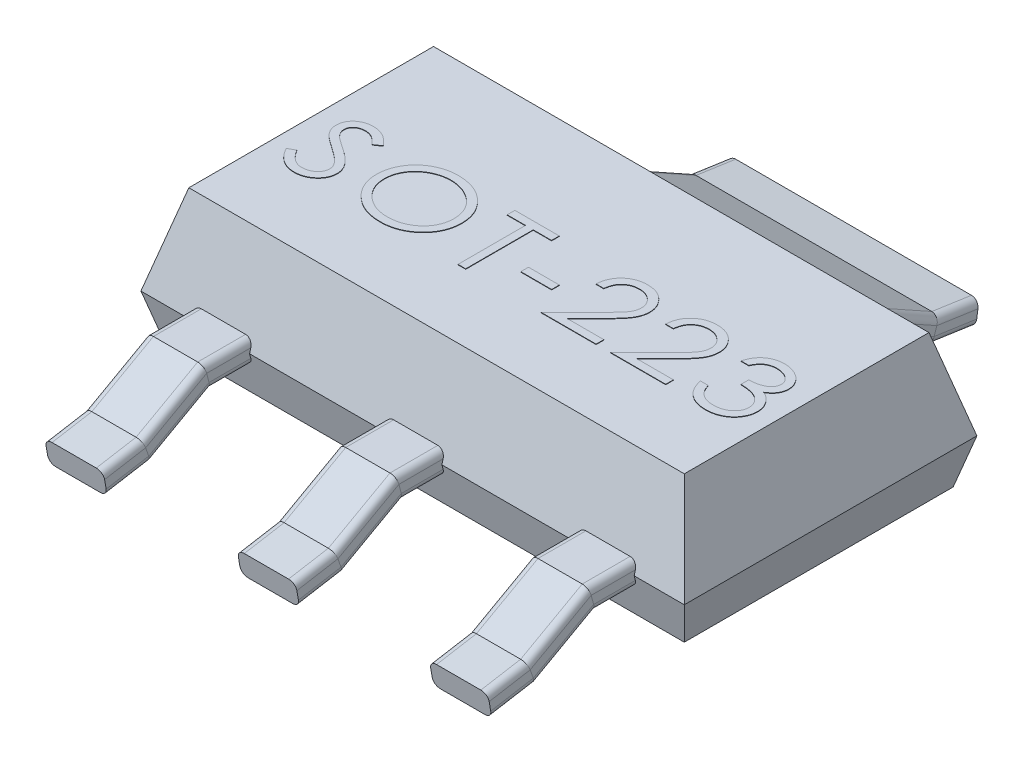
from build123d import *

# Parameters (mm, degrees)
SKETCH1_W                     = 6.5
SKETCH1_H                     = 3.5
BOSS_EXTRUDE1_DEPTH           = 1.07
BOSS_EXTRUDE1_TAPER           = 15
BOSS_EXTRUDE1_OTHER_WAY_DEPTH = 0.53
BOSS_EXTRUDE1_OTHER_WAY_TAPER = 15
SKETCH12_W                    = 0.369230769
SKETCH12_H                    = 0.092307693
BOSS_EXTRUDE2_DEPTH           = 0.005


with BuildPart() as part:
    # Sketch1 → Boss-Extrude1 (new body)
    with BuildSketch(Plane(origin=(0, 0, 0), x_dir=(1, 0, 0), z_dir=(0, 1, 0))):
        Rectangle(SKETCH1_W, SKETCH1_H)
    extrude(amount=BOSS_EXTRUDE1_DEPTH, taper=BOSS_EXTRUDE1_TAPER)

    # Sketch1 → Boss-Extrude1 other way (add)
    with BuildSketch(Plane(origin=(0, 0, 0), x_dir=(1, 0, 0), z_dir=(0, 1, 0))):
        Rectangle(SKETCH1_W, SKETCH1_H)
    extrude(amount=-BOSS_EXTRUDE1_OTHER_WAY_DEPTH, taper=BOSS_EXTRUDE1_OTHER_WAY_TAPER)

    # Sweep1: sweep along a path in Sketch6
    with BuildLine(Plane(origin=(0, 0, 0), x_dir=(0, 0, -1), z_dir=(1, 0, 0))) as sweep1_path:
        Line((-1.607986928, 0), (-2.249183788, 0))
        Line((-2.249183788, 0), (-2.975, -0.404719372))
        Line((-2.975, -0.404719372), (-3.475, -0.49))
    # Sketch4 → Sweep1 (sweep)
    with BuildSketch(Plane.XY.offset(1.607986928)):
        with BuildLine():
            Line((0.264582907, -0.14), (-0.264582907, -0.14))
            ThreePointArc((-0.264582907, -0.14), (-0.324981913, -0.114981913), (-0.35, -0.054582907))
            Line((-0.35, -0.054582907), (-0.35, 0.054582907))
            ThreePointArc((-0.35, 0.054582907), (-0.324981913, 0.114981913), (-0.264582907, 0.14))
            Line((-0.264582907, 0.14), (0.264582907, 0.14))
            ThreePointArc((0.264582907, 0.14), (0.324981913, 0.114981913), (0.35, 0.054582907))
            Line((0.35, 0.054582907), (0.35, -0.054582907))
            ThreePointArc((0.35, -0.054582907), (0.324981913, -0.114981913), (0.264582907, -0.14))
        make_face()
        with BuildLine():
            Line((2.564582907, -0.14), (2.035417093, -0.14))
            ThreePointArc((2.035417093, -0.14), (1.975018087, -0.114981913), (1.95, -0.054582907))
            Line((1.95, -0.054582907), (1.95, 0.054582907))
            ThreePointArc((1.95, 0.054582907), (1.975018087, 0.114981913), (2.035417093, 0.14))
            Line((2.035417093, 0.14), (2.564582907, 0.14))
            ThreePointArc((2.564582907, 0.14), (2.624981913, 0.114981913), (2.65, 0.054582907))
            Line((2.65, 0.054582907), (2.65, -0.054582907))
            ThreePointArc((2.65, -0.054582907), (2.624981913, -0.114981913), (2.564582907, -0.14))
        make_face()
        with BuildLine():
            Line((-2.564582907, 0.14), (-2.035417093, 0.14))
            ThreePointArc((-2.035417093, 0.14), (-1.975018087, 0.114981913), (-1.95, 0.054582907))
            Line((-1.95, 0.054582907), (-1.95, -0.054582907))
            ThreePointArc((-1.95, -0.054582907), (-1.975018087, -0.114981913), (-2.035417093, -0.14))
            Line((-2.035417093, -0.14), (-2.564582907, -0.14))
            ThreePointArc((-2.564582907, -0.14), (-2.624981913, -0.114981913), (-2.65, -0.054582907))
            Line((-2.65, -0.054582907), (-2.65, 0.054582907))
            ThreePointArc((-2.65, 0.054582907), (-2.624981913, 0.114981913), (-2.564582907, 0.14))
        make_face()
    sweep(path=sweep1_path.line, transition=Transition.RIGHT)

    # Sweep2: sweep along a path in Sketch10
    with BuildLine(Plane(origin=(0, 0, 0), x_dir=(0, 0, -1), z_dir=(1, 0, 0))) as sweep2_path:
        Line((3.504979243, -0.49), (3.004979243, -0.417264524))
        Line((3.004979243, -0.417264524), (2.256664789, 0))
        Line((2.256664789, 0), (1.607986928, 0))
    # Sketch9 → Sweep2 (sweep)
    with BuildSketch(Plane.XY.offset(-1.607986928)):
        with BuildLine():
            Line((1.41, 0.14), (-1.41, 0.14))
            ThreePointArc((-1.41, 0.14), (-1.47363961, 0.11363961), (-1.5, 0.05))
            Line((-1.5, 0.05), (-1.5, -0.05))
            ThreePointArc((-1.5, -0.05), (-1.47363961, -0.11363961), (-1.41, -0.14))
            Line((-1.41, -0.14), (1.41, -0.14))
            ThreePointArc((1.41, -0.14), (1.47363961, -0.11363961), (1.5, -0.05))
            Line((1.5, -0.05), (1.5, 0.05))
            ThreePointArc((1.5, 0.05), (1.47363961, 0.11363961), (1.41, 0.14))
        make_face()
    sweep(path=sweep2_path.line, transition=Transition.RIGHT)

    # Sketch12 → Boss-Extrude2 (add)
    # profile 1 of 7: a face of its own
    with BuildSketch(Plane(origin=(0, 1.07, 0), x_dir=(1, 0, 0), z_dir=(0, 1, 0))):
        with BuildLine():
            Line((-2.784230769, -0.478496856), (-2.701838942, -0.432883875))
            add(Edge.make_bspline(
                [(-2.701838942, -0.432883875), (-2.694488246, -0.444753328), (-2.680348045, -0.467586058), (-2.656415422, -0.498095754), (-2.631906469, -0.524138188), (-2.606525769, -0.545627693), (-2.580044955, -0.562216427), (-2.552673626, -0.574147432), (-2.524342713, -0.581549429), (-2.505067301, -0.582438416), (-2.495408654, -0.582883875)],
                knots=[0, 0, 0, 0, 1.253021552, 2.410380904, 3.475470111, 4.460185, 5.388689421, 6.270994921, 7.133619014, 8, 8, 8, 8], degree=3))
            add(Edge.make_bspline(
                [(-2.495408654, -0.582883875), (-2.487158294, -0.582662764), (-2.470800202, -0.582224365), (-2.446746881, -0.578067547), (-2.423429845, -0.571614719), (-2.401285478, -0.562409698), (-2.380590878, -0.551247087), (-2.362315159, -0.537917094), (-2.346709106, -0.522736785), (-2.333902149, -0.505928174), (-2.323806885, -0.487936098), (-2.316548155, -0.46924524), (-2.311955589, -0.449991606), (-2.311422392, -0.436935552), (-2.311153846, -0.430359837)],
                knots=[0, 0, 0, 0, 1.117334146, 2.215352634, 3.29837511, 4.390456354, 5.45848967, 6.478319752, 7.445976648, 8.398987977, 9.332517181, 10.232504492, 11.109796257, 12, 12, 12, 12], degree=3))
            add(Edge.make_bspline(
                [(-2.311153846, -0.430359837), (-2.311599386, -0.422866486), (-2.312505722, -0.407623212), (-2.319132606, -0.385070271), (-2.330000701, -0.362808494), (-2.340008848, -0.349144585), (-2.345228365, -0.342018491)],
                knots=[0, 0, 0, 0, 0.931829012, 1.895563707, 2.902480149, 4, 4, 4, 4], degree=3))
            add(Edge.make_bspline(
                [(-2.345228365, -0.342018491), (-2.349493998, -0.336856549), (-2.35847227, -0.325991735), (-2.373938328, -0.30996128), (-2.391895174, -0.293217446), (-2.412171835, -0.275594354), (-2.435049514, -0.257442637), (-2.460088111, -0.238270312), (-2.48769912, -0.218450984), (-2.50715362, -0.205310556), (-2.517223558, -0.198508875)],
                knots=[0, 0, 0, 0, 0.714762393, 1.504426282, 2.375974636, 3.335718653, 4.371867423, 5.493494949, 6.702595789, 8, 8, 8, 8], degree=3))
            add(Edge.make_bspline(
                [(-2.517223558, -0.198508875), (-2.527236227, -0.19177076), (-2.546366407, -0.178896934), (-2.57313001, -0.159674008), (-2.597197007, -0.142320826), (-2.618148596, -0.126156853), (-2.63630175, -0.111752684), (-2.65144936, -0.098695843), (-2.663575264, -0.087093537), (-2.670328376, -0.079496173), (-2.673353365, -0.07609301)],
                knots=[0, 0, 0, 0, 1.456563732, 2.782907058, 3.976925193, 5.037437426, 5.976523114, 6.773507667, 7.450604967, 8, 8, 8, 8], degree=3))
            add(Edge.make_bspline(
                [(-2.673353365, -0.07609301), (-2.677582464, -0.070805441), (-2.685873629, -0.060439142), (-2.696711174, -0.044095556), (-2.706091796, -0.027488515), (-2.71327968, -0.010326352), (-2.719491223, 0.006920711), (-2.723589734, 0.024647686), (-2.725926231, 0.0427144), (-2.726334195, 0.054849961), (-2.726538462, 0.060926221)],
                knots=[0, 0, 0, 0, 1.082001755, 2.121268478, 3.131939468, 4.126079838, 5.092343318, 6.059513975, 7.028401166, 8, 8, 8, 8], degree=3))
            add(Edge.make_bspline(
                [(-2.726538462, 0.060926221), (-2.726151334, 0.070450474), (-2.725384535, 0.089315537), (-2.719441529, 0.116898525), (-2.709779078, 0.143168277), (-2.696431857, 0.16793306), (-2.679358127, 0.190700992), (-2.659149619, 0.2111639), (-2.63560887, 0.228817858), (-2.609460353, 0.243853889), (-2.581019422, 0.25579467), (-2.551211781, 0.264796493), (-2.520039579, 0.269853828), (-2.498911503, 0.270589306), (-2.488197115, 0.270962279)],
                knots=[0, 0, 0, 0, 0.967956048, 1.917268652, 2.855042101, 3.806653596, 4.767386207, 5.739731228, 6.721252043, 7.750674316, 8.799524247, 9.851450016, 10.91043571, 12, 12, 12, 12], degree=3))
            add(Edge.make_bspline(
                [(-2.488197115, 0.270962279), (-2.476813181, 0.270651339), (-2.454195832, 0.27003357), (-2.420993946, 0.264003731), (-2.388863038, 0.254593096), (-2.363044914, 0.243543813), (-2.342694077, 0.23264659), (-2.327299779, 0.222560911), (-2.311671037, 0.210969475), (-2.295589542, 0.198074834), (-2.279544633, 0.183354426), (-2.263315983, 0.16704689), (-2.246757541, 0.149265227), (-2.235928542, 0.136627102), (-2.230384615, 0.13015699)],
                knots=[0, 0, 0, 0, 1.343581969, 2.669398873, 3.972209689, 5.29212177, 5.978229007, 6.696944897, 7.463666474, 8.276335723, 9.130634109, 10.034185422, 10.993597435, 12, 12, 12, 12], degree=3))
            Line((-2.230384615, 0.13015699), (-2.309350962, 0.074808432))
            add(Edge.make_bspline(
                [(-2.309350962, 0.074808432), (-2.31401641, 0.079876873), (-2.323056696, 0.08969804), (-2.336515698, 0.103596241), (-2.349569652, 0.116030046), (-2.361924035, 0.12733908), (-2.374058696, 0.136940539), (-2.385365851, 0.145623047), (-2.39638318, 0.15255223), (-2.410057521, 0.160357008), (-2.427485229, 0.167690514), (-2.449125823, 0.174072852), (-2.471712817, 0.177939631), (-2.487100604, 0.178414759), (-2.494867788, 0.178654586)],
                knots=[0, 0, 0, 0, 1.1264946, 2.182819734, 3.162837221, 4.074442579, 4.920099024, 5.692522356, 6.404030606, 7.046419284, 8.265828538, 9.484802126, 10.730421381, 12, 12, 12, 12], degree=3))
            add(Edge.make_bspline(
                [(-2.494867788, 0.178654586), (-2.504703846, 0.178344558), (-2.523637733, 0.177747771), (-2.550520138, 0.171205053), (-2.574696104, 0.160920139), (-2.592217749, 0.148694414), (-2.604485827, 0.137538188), (-2.612300165, 0.128471135), (-2.619291317, 0.119233846), (-2.624632595, 0.109122149), (-2.629105787, 0.098742263), (-2.631816537, 0.087700712), (-2.63404079, 0.076399304), (-2.634167079, 0.068630355), (-2.634230769, 0.064712279)],
                knots=[0, 0, 0, 0, 1.760232571, 3.388353894, 4.927632624, 6.445876884, 7.19313098, 7.895540244, 8.589469407, 9.264487784, 9.940794775, 10.609853562, 11.298914165, 12, 12, 12, 12], degree=3))
            add(Edge.make_bspline(
                [(-2.634230769, 0.064712279), (-2.634045796, 0.059893345), (-2.633675678, 0.050250979), (-2.631027071, 0.03592317), (-2.626899811, 0.021742123), (-2.620808381, 0.007630357), (-2.612539528, -0.006745368), (-2.60133824, -0.021282917), (-2.587537574, -0.036480002), (-2.577033751, -0.046359761), (-2.571490385, -0.051573779)],
                knots=[0, 0, 0, 0, 0.847316756, 1.695424412, 2.55504833, 3.440604087, 4.39250749, 5.464392083, 6.661839371, 8, 8, 8, 8], degree=3))
            add(Edge.make_bspline(
                [(-2.571490385, -0.051573779), (-2.569401247, -0.053334338), (-2.564425619, -0.057527402), (-2.555341728, -0.064300894), (-2.543474714, -0.072856018), (-2.528849215, -0.083162924), (-2.511494684, -0.095349579), (-2.49125151, -0.108950412), (-2.468348369, -0.124534181), (-2.452087078, -0.135419365), (-2.443485577, -0.141177145)],
                knots=[0, 0, 0, 0, 0.419436643, 0.998958289, 1.739145775, 2.665983594, 3.746274523, 4.995278854, 6.410635948, 8, 8, 8, 8], degree=3))
            add(Edge.make_bspline(
                [(-2.443485577, -0.141177145), (-2.433106605, -0.148268333), (-2.413070221, -0.16195772), (-2.384669831, -0.182810227), (-2.358679462, -0.202915941), (-2.335274825, -0.222510398), (-2.314397287, -0.241456121), (-2.296153043, -0.259913951), (-2.280162251, -0.277614763), (-2.266893926, -0.295162606), (-2.255589038, -0.312312016), (-2.245804866, -0.32927751), (-2.237482792, -0.346260001), (-2.230569857, -0.363213436), (-2.225235617, -0.38027179), (-2.221803102, -0.397391138), (-2.219191913, -0.41447572), (-2.218961483, -0.425902678), (-2.218846154, -0.431621856)],
                knots=[0, 0, 0, 0, 1.578022906, 3.046339409, 4.422727009, 5.702703616, 6.8776146, 7.96063192, 8.960000702, 9.869926452, 10.719515136, 11.53742413, 12.327003532, 13.091975727, 13.834173186, 14.566643069, 15.282606682, 16, 16, 16, 16], degree=3))
            add(Edge.make_bspline(
                [(-2.218846154, -0.431621856), (-2.21907877, -0.439691222), (-2.219539672, -0.455679764), (-2.223519202, -0.479169863), (-2.229548097, -0.501976408), (-2.238577413, -0.52382809), (-2.2497299, -0.545049608), (-2.263559974, -0.565331708), (-2.279950404, -0.584697598), (-2.298495385, -0.603009069), (-2.318747454, -0.619947035), (-2.340382729, -0.634698437), (-2.363081265, -0.647333205), (-2.386958863, -0.657334974), (-2.411855312, -0.665376358), (-2.437806018, -0.67109332), (-2.464901118, -0.674645662), (-2.483318172, -0.675007274), (-2.492704327, -0.675191568)],
                knots=[0, 0, 0, 0, 0.951595583, 1.885479558, 2.80416064, 3.72995842, 4.668998158, 5.628881797, 6.620439808, 7.65848502, 8.700881629, 9.731609297, 10.744171855, 11.761046479, 12.781500572, 13.827629713, 14.892862811, 16, 16, 16, 16], degree=3))
            add(Edge.make_bspline(
                [(-2.492704327, -0.675191568), (-2.499982703, -0.675064572), (-2.514331904, -0.674814202), (-2.535571528, -0.672473753), (-2.556347273, -0.669224233), (-2.576539261, -0.664036892), (-2.596318981, -0.657742208), (-2.615578489, -0.650041586), (-2.634261164, -0.640709285), (-2.652533408, -0.630112587), (-2.670376489, -0.617691963), (-2.687800185, -0.603478464), (-2.704844247, -0.587318896), (-2.721364291, -0.569174186), (-2.737842685, -0.54934394), (-2.753822877, -0.527531625), (-2.769387192, -0.503772631), (-2.779193738, -0.487073958), (-2.784230769, -0.478496856)],
                knots=[0, 0, 0, 0, 0.9415657, 1.856281696, 2.762794391, 3.66065843, 4.551013359, 5.447866327, 6.341746891, 7.251456702, 8.179140589, 9.152078792, 10.158839414, 11.215634977, 12.32593623, 13.494135372, 14.712888492, 16, 16, 16, 16], degree=3))
        make_face()
    # profile 2 of 7: a face of its own
    with BuildSketch(Plane(origin=(0, 1.07, 0), x_dir=(1, 0, 0), z_dir=(0, 1, 0))):
        with BuildLine():
            add(Edge.make_bspline(
                [(-1.474002404, 0.270962279), (-1.456077081, 0.270538981), (-1.42089361, 0.269708141), (-1.369253317, 0.263401471), (-1.319980301, 0.252380756), (-1.272683413, 0.237814507), (-1.227832317, 0.21832086), (-1.185164796, 0.194781381), (-1.144791581, 0.16683965), (-1.107072918, 0.134948296), (-1.072697091, 0.10010053), (-1.042390572, 0.062988861), (-1.017187686, 0.02359048), (-0.995888227, -0.017471306), (-0.979962811, -0.060846308), (-0.968298992, -0.106058302), (-0.961356905, -0.153281929), (-0.960456542, -0.185445211), (-0.96, -0.201754068)],
                knots=[0, 0, 0, 0, 1.104339174, 2.167575275, 3.19895946, 4.211974237, 5.212103104, 6.206540156, 7.210035823, 8.232212855, 9.245525355, 10.222267028, 11.178495095, 12.122427609, 13.066774007, 14.018748382, 14.995377748, 16, 16, 16, 16], degree=3))
            add(Edge.make_bspline(
                [(-0.96, -0.201754068), (-0.960454531, -0.21794357), (-0.961350867, -0.249869247), (-0.968329291, -0.296782845), (-0.979930058, -0.341779888), (-0.996035118, -0.384972843), (-1.01686575, -0.42628543), (-1.042543926, -0.465566582), (-1.072600754, -0.503014694), (-1.106883738, -0.538092949), (-1.144372688, -0.570063489), (-1.184292524, -0.598242846), (-1.226187146, -0.622195315), (-1.270357832, -0.64150922), (-1.316381181, -0.656776704), (-1.364550627, -0.667279716), (-1.414616801, -0.674013804), (-1.448739976, -0.674794888), (-1.466069712, -0.675191568)],
                knots=[0, 0, 0, 0, 1.006897034, 1.98559964, 2.943186421, 3.893189035, 4.847917768, 5.815452073, 6.80748931, 7.830684368, 8.862341799, 9.868509738, 10.866468422, 11.859160648, 12.862936224, 13.87796334, 14.922306222, 16, 16, 16, 16], degree=3))
            add(Edge.make_bspline(
                [(-1.466069712, -0.675191568), (-1.483579566, -0.674795527), (-1.51806165, -0.674015607), (-1.568723812, -0.667262522), (-1.617360784, -0.656809873), (-1.663847693, -0.641709367), (-1.708232444, -0.622334866), (-1.750591497, -0.598638511), (-1.790733408, -0.570521116), (-1.828325751, -0.538586081), (-1.862702584, -0.503799584), (-1.892921449, -0.466692395), (-1.918215386, -0.427562325), (-1.939140967, -0.386761999), (-1.955499355, -0.344170401), (-1.967019754, -0.299725342), (-1.974041451, -0.253480445), (-1.974932633, -0.222031158), (-1.975384615, -0.206080991)],
                knots=[0, 0, 0, 0, 1.090007837, 2.146547848, 3.177224824, 4.18441606, 5.184972819, 6.188625542, 7.201944888, 8.232227685, 9.256408654, 10.243626549, 11.2069681, 12.152656664, 13.094449289, 14.042142631, 15.007031417, 16, 16, 16, 16], degree=3))
            add(Edge.make_bspline(
                [(-1.975384615, -0.206080991), (-1.975163489, -0.195376927), (-1.974724065, -0.174105669), (-1.971601785, -0.14247401), (-1.96639283, -0.111383164), (-1.958955843, -0.080922659), (-1.949578611, -0.051019483), (-1.937991119, -0.021746458), (-1.924272774, 0.006904025), (-1.908558444, 0.034810276), (-1.891233213, 0.06176474), (-1.872013449, 0.087262075), (-1.851304446, 0.11124627), (-1.829025032, 0.133658631), (-1.805360274, 0.154616852), (-1.780210812, 0.174157916), (-1.753515848, 0.192247868), (-1.725225352, 0.20849711), (-1.696054104, 0.223317182), (-1.66597513, 0.235868553), (-1.635499268, 0.246774937), (-1.604364449, 0.255630166), (-1.572625391, 0.262495492), (-1.540277566, 0.267260504), (-1.507363853, 0.270557537), (-1.485188516, 0.270826569), (-1.474002404, 0.270962279)],
                knots=[0, 0, 0, 0, 1.000860702, 1.988923732, 2.969140983, 3.946405888, 4.918600368, 5.897447419, 6.887793071, 7.886663957, 8.890501988, 9.881803818, 10.869866848, 11.851371953, 12.834677219, 13.823874237, 14.827633617, 15.847405218, 16.872782081, 17.885187697, 18.892981817, 19.898014594, 20.909858577, 21.927149733, 22.954372848, 24, 24, 24, 24], degree=3))
        make_face()
        with BuildLine():
            add(Edge.make_bspline(
                [(-1.469675481, 0.178654586), (-1.478696766, 0.178550408), (-1.49665561, 0.178343018), (-1.523369237, 0.175613374), (-1.549749182, 0.17172418), (-1.575800081, 0.166176819), (-1.601429891, 0.158620703), (-1.62683938, 0.149909384), (-1.6518084, 0.139373915), (-1.676186958, 0.127285403), (-1.699907854, 0.114134475), (-1.722275028, 0.099491082), (-1.743271031, 0.083678811), (-1.763127923, 0.067003542), (-1.781556347, 0.049103748), (-1.798611616, 0.03007136), (-1.814263814, 0.0098415), (-1.828660436, -0.011316672), (-1.841479407, -0.033371592), (-1.852723442, -0.056101255), (-1.862091758, -0.079562688), (-1.869649863, -0.103630505), (-1.87563207, -0.128261141), (-1.879971399, -0.153491531), (-1.882524942, -0.179405656), (-1.8828915, -0.196880688), (-1.883076923, -0.205720414)],
                knots=[0, 0, 0, 0, 1.034314358, 2.059029303, 3.076765405, 4.092094375, 5.110880351, 6.139806059, 7.171636845, 8.216667878, 9.259764826, 10.280693852, 11.280175756, 12.273075775, 13.252873351, 14.224294354, 15.201858716, 16.184537379, 17.157522275, 18.125488912, 19.09060439, 20.051995777, 21.016643451, 21.995737629, 22.98614617, 24, 24, 24, 24], degree=3))
            add(Edge.make_bspline(
                [(-1.883076923, -0.205720414), (-1.882674079, -0.218719492), (-1.881881376, -0.24429864), (-1.876262796, -0.281882028), (-1.866555156, -0.317782286), (-1.853429846, -0.35234078), (-1.836113634, -0.385185253), (-1.815313051, -0.416674108), (-1.790321733, -0.44621881), (-1.762256821, -0.47421843), (-1.731319288, -0.499518877), (-1.698581925, -0.521822146), (-1.664287075, -0.540789968), (-1.62827399, -0.556011017), (-1.590865825, -0.568283042), (-1.551813123, -0.576581752), (-1.511299929, -0.582096745), (-1.483696705, -0.58261873), (-1.469675481, -0.582883875)],
                knots=[0, 0, 0, 0, 1.001985766, 1.97167371, 2.92126608, 3.864235468, 4.815363556, 5.777764185, 6.767768529, 7.793129838, 8.830022713, 9.843858898, 10.843270901, 11.845781331, 12.853757634, 13.873335827, 14.919748107, 16, 16, 16, 16], degree=3))
            add(Edge.make_bspline(
                [(-1.469675481, -0.582883875), (-1.460235428, -0.582760768), (-1.441505788, -0.582516516), (-1.413691173, -0.580089414), (-1.386412993, -0.57615904), (-1.359701336, -0.570521689), (-1.333526662, -0.56346649), (-1.307794816, -0.555080526), (-1.282780404, -0.544667815), (-1.258275722, -0.533061619), (-1.234795136, -0.519889684), (-1.212338173, -0.505734884), (-1.191420013, -0.490113052), (-1.171720921, -0.473572815), (-1.15339784, -0.455803886), (-1.136486854, -0.436827776), (-1.120678892, -0.41681667), (-1.106538792, -0.395516384), (-1.09371998, -0.373471703), (-1.082730769, -0.350650371), (-1.073288459, -0.327298121), (-1.065523494, -0.303333239), (-1.059548031, -0.278744959), (-1.055455124, -0.253545613), (-1.052853415, -0.22777009), (-1.052490602, -0.210354004), (-1.052307692, -0.201573779)],
                knots=[0, 0, 0, 0, 1.078057494, 2.138931934, 3.186396846, 4.224372019, 5.255081129, 6.281828204, 7.313085757, 8.34778727, 9.37721554, 10.386466275, 11.377698063, 12.356805186, 13.322831121, 14.290221845, 15.258318578, 16.233084811, 17.207971885, 18.168911637, 19.123652981, 20.083145109, 21.043790605, 22.010913397, 22.997212883, 24, 24, 24, 24], degree=3))
            add(Edge.make_bspline(
                [(-1.052307692, -0.201573779), (-1.052490691, -0.192853639), (-1.052853663, -0.175557469), (-1.055453782, -0.149961364), (-1.059552463, -0.124943431), (-1.06549451, -0.100584354), (-1.073292895, -0.076927824), (-1.082731661, -0.053934391), (-1.093727044, -0.031475942), (-1.106532264, -0.009781501), (-1.12074564, 0.01116192), (-1.136470563, 0.031049395), (-1.153655592, 0.049766203), (-1.172083743, 0.067613382), (-1.192134787, 0.084023682), (-1.213312285, 0.099745903), (-1.236051986, 0.114051445), (-1.259946386, 0.127349985), (-1.284665779, 0.139372363), (-1.309945144, 0.149867931), (-1.335677562, 0.158693925), (-1.361701733, 0.166139712), (-1.388216536, 0.171751448), (-1.415024301, 0.17559526), (-1.442214593, 0.178351917), (-1.460473747, 0.178553166), (-1.469675481, 0.178654586)],
                knots=[0, 0, 0, 0, 0.999618921, 1.982718035, 2.946629433, 3.904142108, 4.854089328, 5.799603779, 6.751722253, 7.718313886, 8.685273778, 9.65154614, 10.6220342, 11.596597958, 12.589904812, 13.590354425, 14.618671442, 15.667306976, 16.72423902, 17.768315198, 18.803281207, 19.841475733, 20.86981583, 21.90753015, 22.945496034, 24, 24, 24, 24], degree=3))
        make_face(mode=Mode.SUBTRACT)
    # profile 3 of 7: a face of its own
    with BuildSketch(Plane(origin=(0, 1.07, 0), x_dir=(1, 0, 0), z_dir=(0, 1, 0))):
        Polygon((-0.774230769, 0.155577663), (-0.774230769, 0.247885355), (-0.243461538, 0.247885355), (-0.243461538, 0.155577663), (-0.462692308, 0.155577663), (-0.462692308, -0.652114645), (-0.555, -0.652114645), (-0.555, 0.155577663), align=None)
    # profile 4 of 7: a face of its own
    with BuildSketch(Plane(origin=(0, 1.07, 0), x_dir=(1, 0, 0), z_dir=(0, 1, 0))):
        with Locations((0.08076923, -0.305960799)):
            Rectangle(SKETCH12_W, SKETCH12_H)
    # profile 5 of 7: a face of its own
    with BuildSketch(Plane(origin=(0, 1.07, 0), x_dir=(1, 0, 0), z_dir=(0, 1, 0))):
        with BuildLine():
            Line((0.566538462, -0.029037721), (0.474230769, -0.029037721))
            add(Edge.make_bspline(
                [(0.474230769, -0.029037721), (0.474810197, -0.018321314), (0.475948978, 0.002740207), (0.481078528, 0.033478001), (0.488876087, 0.062752113), (0.499266374, 0.090599209), (0.512650589, 0.116881938), (0.528253722, 0.14195702), (0.547048657, 0.165272026), (0.568232378, 0.186941509), (0.59131058, 0.206662206), (0.615954921, 0.223965934), (0.642066689, 0.238369098), (0.669366625, 0.25038255), (0.698086652, 0.259571524), (0.728067352, 0.266234862), (0.759454707, 0.270312706), (0.780828959, 0.270743034), (0.79171875, 0.270962279)],
                knots=[0, 0, 0, 0, 1.058365535, 2.080061621, 3.068269832, 4.044123835, 5.006807913, 5.974210925, 6.953123194, 7.955376811, 8.960713323, 9.944481168, 10.921343657, 11.898584061, 12.883138005, 13.891687467, 14.925853214, 16, 16, 16, 16], degree=3))
            add(Edge.make_bspline(
                [(0.79171875, 0.270962279), (0.802427312, 0.270731274), (0.823373272, 0.270279428), (0.854030131, 0.266407552), (0.883098113, 0.26009753), (0.910721209, 0.25152845), (0.936633135, 0.240090677), (0.960887703, 0.226055769), (0.983841572, 0.209848248), (1.004659989, 0.190883971), (1.023643543, 0.170589615), (1.040216767, 0.149083711), (1.054397157, 0.126770918), (1.065730493, 0.10329288), (1.074880683, 0.079143488), (1.081165305, 0.053972666), (1.085067831, 0.02793642), (1.085533513, 0.010218939), (1.085769231, 0.00125074)],
                knots=[0, 0, 0, 0, 1.153801189, 2.256836437, 3.323993489, 4.356423587, 5.368539985, 6.369549116, 7.372463318, 8.390695778, 9.398949994, 10.364113306, 11.312947386, 12.242800634, 13.16917339, 14.091302172, 15.033859197, 16, 16, 16, 16], degree=3))
            add(Edge.make_bspline(
                [(1.085769231, 0.00125074), (1.085279516, -0.011346502), (1.084305626, -0.036398495), (1.076596981, -0.073266782), (1.064326898, -0.108967714), (1.049592036, -0.137599786), (1.034991426, -0.1607309), (1.021532507, -0.179669975), (1.005843149, -0.200128386), (0.987981924, -0.222231417), (0.967539869, -0.245520352), (0.944952803, -0.270531017), (0.919929169, -0.296904545), (0.902321217, -0.314879959), (0.893221154, -0.324169933)],
                knots=[0, 0, 0, 0, 1.165482123, 2.3177811, 3.472093297, 4.651569522, 5.289127253, 6.003857704, 6.801763299, 7.675949041, 8.634330951, 9.670326313, 10.795988365, 12, 12, 12, 12], degree=3))
            Line((0.893221154, -0.324169933), (0.657584135, -0.559806952))
            Line((0.657584135, -0.559806952), (1.097307692, -0.559806952))
            Line((1.097307692, -0.559806952), (1.097307692, -0.652114645))
            Line((1.097307692, -0.652114645), (0.439615385, -0.652114645))
            Line((0.439615385, -0.652114645), (0.811911058, -0.279638683))
            add(Edge.make_bspline(
                [(0.811911058, -0.279638683), (0.820939008, -0.270758339), (0.838297988, -0.253683176), (0.863017244, -0.228934842), (0.885023822, -0.205746504), (0.904762653, -0.184486866), (0.921999876, -0.164985418), (0.936743042, -0.147196712), (0.949030328, -0.131252047), (0.961952592, -0.11247372), (0.974617695, -0.089693465), (0.985615159, -0.061796724), (0.99218547, -0.033007097), (0.99303479, -0.013565792), (0.993461538, -0.003797337)],
                knots=[0, 0, 0, 0, 1.343082261, 2.582484091, 3.709530028, 4.733396915, 5.659164388, 6.469527046, 7.183409814, 7.793323211, 8.885980508, 9.939397012, 10.964631844, 12, 12, 12, 12], degree=3))
            add(Edge.make_bspline(
                [(0.993461538, -0.003797337), (0.993310106, 0.00234479), (0.993011431, 0.014459139), (0.989986428, 0.032225985), (0.98528059, 0.049323698), (0.978760999, 0.065860858), (0.970291469, 0.081709824), (0.959835207, 0.096788186), (0.947684318, 0.111310009), (0.933775393, 0.124984341), (0.918528344, 0.137554723), (0.902287319, 0.148645766), (0.885062457, 0.157807714), (0.867098712, 0.165448529), (0.848283908, 0.171461294), (0.828574251, 0.175503709), (0.808075092, 0.178128981), (0.794130861, 0.178477262), (0.78703125, 0.178654586)],
                knots=[0, 0, 0, 0, 0.962340989, 1.89806141, 2.817120788, 3.739315004, 4.679437949, 5.628257868, 6.611593212, 7.64443402, 8.682078366, 9.706632143, 10.722700226, 11.73609922, 12.764286792, 13.814055302, 14.887040945, 16, 16, 16, 16], degree=3))
            add(Edge.make_bspline(
                [(0.78703125, 0.178654586), (0.779572663, 0.178472327), (0.764972412, 0.178115552), (0.743542284, 0.175583847), (0.723107856, 0.17122104), (0.70360077, 0.165304955), (0.685037246, 0.15769589), (0.667454001, 0.148274294), (0.650856657, 0.137009423), (0.63520759, 0.124306288), (0.620882948, 0.110040528), (0.608229785, 0.0941969), (0.597000079, 0.077112289), (0.587598524, 0.058519849), (0.579809557, 0.038594326), (0.573819128, 0.017249715), (0.568926165, -0.005366115), (0.567347005, -0.021021853), (0.566538462, -0.029037721)],
                knots=[0, 0, 0, 0, 1.062482834, 2.079819764, 3.068843583, 4.035681427, 4.980083784, 5.922349349, 6.87216912, 7.833571084, 8.790081163, 9.746093011, 10.717318031, 11.697520243, 12.708678188, 13.760030157, 14.853116795, 16, 16, 16, 16], degree=3))
        make_face()
    # profile 6 of 7: a face of its own
    with BuildSketch(Plane(origin=(0, 1.07, 0), x_dir=(1, 0, 0), z_dir=(0, 1, 0))):
        with BuildLine():
            Line((1.398461538, -0.029037721), (1.306153846, -0.029037721))
            add(Edge.make_bspline(
                [(1.306153846, -0.029037721), (1.306733274, -0.018321314), (1.307872055, 0.002740207), (1.313001605, 0.033478001), (1.320799164, 0.062752113), (1.331189451, 0.090599209), (1.344573666, 0.116881938), (1.360176799, 0.14195702), (1.378971734, 0.165272026), (1.400155454, 0.186941509), (1.423233657, 0.206662206), (1.447877998, 0.223965934), (1.473989766, 0.238369098), (1.501289702, 0.25038255), (1.530009729, 0.259571524), (1.559990429, 0.266234862), (1.591377784, 0.270312706), (1.612752035, 0.270743034), (1.623641827, 0.270962279)],
                knots=[0, 0, 0, 0, 1.058365535, 2.080061621, 3.068269832, 4.044123835, 5.006807913, 5.974210925, 6.953123194, 7.955376811, 8.960713323, 9.944481168, 10.921343657, 11.898584061, 12.883138005, 13.891687467, 14.925853214, 16, 16, 16, 16], degree=3))
            add(Edge.make_bspline(
                [(1.623641827, 0.270962279), (1.634350389, 0.270731274), (1.655296349, 0.270279428), (1.685953208, 0.266407552), (1.71502119, 0.26009753), (1.742644286, 0.25152845), (1.768556212, 0.240090677), (1.79281078, 0.226055769), (1.815764649, 0.209848248), (1.836583066, 0.190883971), (1.85556662, 0.170589615), (1.872139844, 0.149083711), (1.886320234, 0.126770918), (1.89765357, 0.10329288), (1.90680376, 0.079143488), (1.913088382, 0.053972666), (1.916990908, 0.02793642), (1.91745659, 0.010218939), (1.917692308, 0.00125074)],
                knots=[0, 0, 0, 0, 1.153801189, 2.256836437, 3.323993489, 4.356423587, 5.368539985, 6.369549116, 7.372463318, 8.390695778, 9.398949994, 10.364113306, 11.312947386, 12.242800634, 13.16917339, 14.091302172, 15.033859197, 16, 16, 16, 16], degree=3))
            add(Edge.make_bspline(
                [(1.917692308, 0.00125074), (1.917202593, -0.011346502), (1.916228703, -0.036398495), (1.908520058, -0.073266782), (1.896249975, -0.108967714), (1.881515113, -0.137599786), (1.866914503, -0.1607309), (1.853455584, -0.179669975), (1.837766226, -0.200128386), (1.819905001, -0.222231417), (1.799462946, -0.245520352), (1.776875879, -0.270531017), (1.751852245, -0.296904545), (1.734244294, -0.314879959), (1.725144231, -0.324169933)],
                knots=[0, 0, 0, 0, 1.165482123, 2.3177811, 3.472093297, 4.651569522, 5.289127253, 6.003857704, 6.801763299, 7.675949041, 8.634330951, 9.670326313, 10.795988365, 12, 12, 12, 12], degree=3))
            Line((1.725144231, -0.324169933), (1.489507212, -0.559806952))
            Line((1.489507212, -0.559806952), (1.929230769, -0.559806952))
            Line((1.929230769, -0.559806952), (1.929230769, -0.652114645))
            Line((1.929230769, -0.652114645), (1.271538462, -0.652114645))
            Line((1.271538462, -0.652114645), (1.643834135, -0.279638683))
            add(Edge.make_bspline(
                [(1.643834135, -0.279638683), (1.652862085, -0.270758339), (1.670221065, -0.253683176), (1.694940321, -0.228934842), (1.716946899, -0.205746504), (1.73668573, -0.184486866), (1.753922952, -0.164985418), (1.768666119, -0.147196712), (1.780953405, -0.131252047), (1.793875669, -0.11247372), (1.806540772, -0.089693465), (1.817538236, -0.061796724), (1.824108547, -0.033007097), (1.824957867, -0.013565792), (1.825384615, -0.003797337)],
                knots=[0, 0, 0, 0, 1.343082261, 2.582484091, 3.709530028, 4.733396915, 5.659164388, 6.469527046, 7.183409814, 7.793323211, 8.885980508, 9.939397012, 10.964631844, 12, 12, 12, 12], degree=3))
            add(Edge.make_bspline(
                [(1.825384615, -0.003797337), (1.825233183, 0.00234479), (1.824934508, 0.014459139), (1.821909504, 0.032225985), (1.817203667, 0.049323698), (1.810684075, 0.065860858), (1.802214546, 0.081709824), (1.791758284, 0.096788186), (1.779607395, 0.111310009), (1.76569847, 0.124984341), (1.750451421, 0.137554723), (1.734210396, 0.148645766), (1.716985533, 0.157807714), (1.699021789, 0.165448529), (1.680206985, 0.171461294), (1.660497328, 0.175503709), (1.639998169, 0.178128981), (1.626053938, 0.178477262), (1.618954327, 0.178654586)],
                knots=[0, 0, 0, 0, 0.962340989, 1.89806141, 2.817120788, 3.739315004, 4.679437949, 5.628257868, 6.611593212, 7.64443402, 8.682078366, 9.706632143, 10.722700226, 11.73609922, 12.764286792, 13.814055302, 14.887040945, 16, 16, 16, 16], degree=3))
            add(Edge.make_bspline(
                [(1.618954327, 0.178654586), (1.61149574, 0.178472327), (1.596895489, 0.178115552), (1.57546536, 0.175583847), (1.555030933, 0.17122104), (1.535523847, 0.165304955), (1.516960323, 0.15769589), (1.499377078, 0.148274294), (1.482779734, 0.137009423), (1.467130667, 0.124306288), (1.452806025, 0.110040528), (1.440152862, 0.0941969), (1.428923156, 0.077112289), (1.419521601, 0.058519849), (1.411732634, 0.038594326), (1.405742205, 0.017249715), (1.400849241, -0.005366115), (1.399270081, -0.021021853), (1.398461538, -0.029037721)],
                knots=[0, 0, 0, 0, 1.062482834, 2.079819764, 3.068843583, 4.035681427, 4.980083784, 5.922349349, 6.87216912, 7.833571084, 8.790081163, 9.746093011, 10.717318031, 11.697520243, 12.708678188, 13.760030157, 14.853116795, 16, 16, 16, 16], degree=3))
        make_face()
    # profile 7 of 7: a face of its own
    with BuildSketch(Plane(origin=(0, 1.07, 0), x_dir=(1, 0, 0), z_dir=(0, 1, 0))):
        with BuildLine():
            Line((2.230384615, 0.040193048), (2.138076923, 0.040193048))
            add(Edge.make_bspline(
                [(2.138076923, 0.040193048), (2.140509203, 0.049255274), (2.145269382, 0.066990827), (2.154863047, 0.092337073), (2.165565609, 0.116234744), (2.178061625, 0.138492056), (2.192136958, 0.159164455), (2.207964732, 0.178103186), (2.225017599, 0.195749792), (2.243907171, 0.211351925), (2.263805439, 0.22543421), (2.284850515, 0.237535118), (2.306738521, 0.247842789), (2.329505107, 0.256385236), (2.353243986, 0.262840737), (2.377778596, 0.267479361), (2.403205004, 0.270522418), (2.420459831, 0.270813907), (2.429242788, 0.270962279)],
                knots=[0, 0, 0, 0, 1.116355944, 2.184804219, 3.222141051, 4.231113984, 5.219328683, 6.194876446, 7.166217883, 8.136267484, 9.106844572, 10.065215996, 11.022117626, 11.98422021, 12.956167426, 13.946761748, 14.954871942, 16, 16, 16, 16], degree=3))
            add(Edge.make_bspline(
                [(2.429242788, 0.270962279), (2.442008884, 0.270606162), (2.467271374, 0.269901453), (2.504400812, 0.263524248), (2.540200827, 0.253412332), (2.574246878, 0.239415632), (2.605847767, 0.22212323), (2.634108007, 0.201722415), (2.658293214, 0.178154857), (2.67870364, 0.152315867), (2.694663814, 0.124594784), (2.70642535, 0.0960868), (2.713610648, 0.066807583), (2.714536823, 0.04702257), (2.715, 0.037128144)],
                knots=[0, 0, 0, 0, 1.123321227, 2.222910833, 3.306649022, 4.393470362, 5.456864647, 6.471880394, 7.452320752, 8.420908763, 9.362108778, 10.259259549, 11.129460877, 12, 12, 12, 12], degree=3))
            add(Edge.make_bspline(
                [(2.715, 0.037128144), (2.714687754, 0.027602954), (2.714075343, 0.008921116), (2.708226471, -0.018268606), (2.698989716, -0.043942551), (2.686097687, -0.068191374), (2.669205011, -0.090674814), (2.648844545, -0.11173841), (2.624652505, -0.131117111), (2.606595356, -0.142269582), (2.597271635, -0.148028106)],
                knots=[0, 0, 0, 0, 0.989635591, 1.940980818, 2.878257013, 3.820688598, 4.785857322, 5.793802215, 6.860840457, 8, 8, 8, 8], degree=3))
            add(Edge.make_bspline(
                [(2.597271635, -0.148028106), (2.607692482, -0.152622277), (2.628166474, -0.161648512), (2.656092379, -0.179761263), (2.681559929, -0.200332937), (2.69580914, -0.216674968), (2.702920673, -0.224830991)],
                knots=[0, 0, 0, 0, 1.034096765, 2.031705015, 3.017658317, 4, 4, 4, 4], degree=3))
            add(Edge.make_bspline(
                [(2.702920673, -0.224830991), (2.707617887, -0.230749249), (2.716901588, -0.242446257), (2.728411099, -0.261379645), (2.738800474, -0.280480294), (2.746721363, -0.300414473), (2.753421261, -0.320642398), (2.757848767, -0.341563906), (2.760641707, -0.362975665), (2.760982585, -0.377466515), (2.761153846, -0.384746856)],
                knots=[0, 0, 0, 0, 1.043047349, 2.06150724, 3.057059767, 4.044020338, 5.020973223, 5.99827899, 6.994316291, 8, 8, 8, 8], degree=3))
            add(Edge.make_bspline(
                [(2.761153846, -0.384746856), (2.761000186, -0.391061687), (2.760693591, -0.403661538), (2.758680596, -0.42247108), (2.755276871, -0.441041682), (2.750335489, -0.459410497), (2.744018059, -0.477521182), (2.736488066, -0.495471478), (2.727279597, -0.512995), (2.717208404, -0.530408549), (2.70563371, -0.547068883), (2.69317695, -0.563013986), (2.679747852, -0.578033082), (2.664915372, -0.591676809), (2.649512863, -0.60479894), (2.632812838, -0.616602862), (2.615328099, -0.627721118), (2.596767317, -0.637533738), (2.577449849, -0.646396528), (2.557523275, -0.654105728), (2.537012487, -0.660688831), (2.515957773, -0.665809619), (2.4943649, -0.670011602), (2.472222978, -0.673072306), (2.449467231, -0.674925716), (2.43411406, -0.675102342), (2.426358173, -0.675191568)],
                knots=[0, 0, 0, 0, 0.92169803, 1.839044851, 2.757774576, 3.674827786, 4.612457936, 5.555774093, 6.513016878, 7.499902905, 8.490174619, 9.47107816, 10.452334622, 11.426626846, 12.410467524, 13.403648671, 14.408766131, 15.432992845, 16.465300959, 17.509466555, 18.549756312, 19.60710264, 20.67025462, 21.759431652, 22.868142969, 24, 24, 24, 24], degree=3))
            add(Edge.make_bspline(
                [(2.426358173, -0.675191568), (2.415954972, -0.674971911), (2.395583113, -0.674541772), (2.365657501, -0.671517288), (2.337161242, -0.666069817), (2.309926586, -0.658622673), (2.283914372, -0.64935033), (2.259252306, -0.637705479), (2.235917464, -0.624003463), (2.214075318, -0.608102246), (2.193809354, -0.590160322), (2.175152758, -0.570339906), (2.158512586, -0.548343824), (2.143764133, -0.524459791), (2.130599542, -0.498722579), (2.119845083, -0.470833742), (2.11018621, -0.441175234), (2.105739508, -0.4204329), (2.103461538, -0.409806952)],
                knots=[0, 0, 0, 0, 1.089030947, 2.132572979, 3.144340947, 4.122636792, 5.085826611, 6.031433048, 6.973369982, 7.914634373, 8.855057411, 9.803109251, 10.759391439, 11.737019511, 12.738643989, 13.780724783, 14.863102731, 16, 16, 16, 16], degree=3))
            Line((2.103461538, -0.409806952), (2.195769231, -0.409806952))
            add(Edge.make_bspline(
                [(2.195769231, -0.409806952), (2.197991615, -0.416738623), (2.202316573, -0.430228274), (2.209663176, -0.449622963), (2.217922148, -0.467457187), (2.226999779, -0.483723534), (2.23652835, -0.498620782), (2.246837665, -0.512066092), (2.257930822, -0.523997602), (2.266071873, -0.530856169), (2.270048077, -0.534205991)],
                knots=[0, 0, 0, 0, 1.187591516, 2.311159086, 3.381569441, 4.391100686, 5.348474685, 6.26437783, 7.152297666, 8, 8, 8, 8], degree=3))
            add(Edge.make_bspline(
                [(2.270048077, -0.534205991), (2.275330485, -0.538090752), (2.285888855, -0.545855534), (2.303041971, -0.555801457), (2.321158257, -0.564324227), (2.340565348, -0.570914107), (2.360833443, -0.576398161), (2.382262946, -0.580079566), (2.404665504, -0.582546552), (2.419980965, -0.582769862), (2.427800481, -0.582883875)],
                knots=[0, 0, 0, 0, 0.934841818, 1.868542889, 2.823608252, 3.786147903, 4.788489089, 5.816032122, 6.884945635, 8, 8, 8, 8], degree=3))
            add(Edge.make_bspline(
                [(2.427800481, -0.582883875), (2.436703212, -0.58272646), (2.454070817, -0.582419372), (2.479362144, -0.579577698), (2.50336219, -0.57542716), (2.525915549, -0.568962828), (2.547352179, -0.561203333), (2.567215406, -0.551094778), (2.585933386, -0.539633467), (2.602962471, -0.52623756), (2.618340738, -0.511804966), (2.631773693, -0.496569268), (2.64327274, -0.480802823), (2.652688208, -0.464378772), (2.66003176, -0.447273239), (2.665005515, -0.429499532), (2.668204121, -0.411183583), (2.668630936, -0.398762484), (2.668846154, -0.39249926)],
                knots=[0, 0, 0, 0, 1.249364874, 2.437282909, 3.569203944, 4.664369636, 5.726875827, 6.764470109, 7.787556699, 8.80352195, 9.800248248, 10.744722387, 11.650966389, 12.535226244, 13.397106462, 14.257002303, 15.1211095, 16, 16, 16, 16], degree=3))
            add(Edge.make_bspline(
                [(2.668846154, -0.39249926), (2.668484068, -0.384106607), (2.667760463, -0.367334479), (2.661267662, -0.34275227), (2.651101769, -0.318989618), (2.636717798, -0.296582395), (2.619202705, -0.275782398), (2.598665411, -0.257388992), (2.575246093, -0.24194533), (2.553539641, -0.231429274), (2.534281166, -0.22432097), (2.517854229, -0.219440716), (2.499502977, -0.215421978), (2.479317266, -0.211586459), (2.457232854, -0.208427293), (2.433305483, -0.205716948), (2.407512541, -0.20355707), (2.38964251, -0.202606898), (2.380384615, -0.202114645)],
                knots=[0, 0, 0, 0, 1.042984283, 2.08433108, 3.143128335, 4.249222157, 5.385113909, 6.51878688, 7.668120448, 8.865777362, 9.511886398, 10.22190494, 10.99673624, 11.849106467, 12.778958184, 13.77268577, 14.846099398, 16, 16, 16, 16], degree=3))
            Line((2.380384615, -0.202114645), (2.380384615, -0.109806952))
            add(Edge.make_bspline(
                [(2.380384615, -0.109806952), (2.392059317, -0.10961773), (2.414945523, -0.109246792), (2.448421589, -0.104765006), (2.480444128, -0.098602894), (2.510284679, -0.089119121), (2.537419061, -0.078099521), (2.560956853, -0.065296964), (2.580580359, -0.051066175), (2.596201453, -0.035177671), (2.6079837, -0.018122504), (2.61648141, -0.000305491), (2.621814895, 0.018311406), (2.622399279, 0.03108408), (2.622692308, 0.037488721)],
                knots=[0, 0, 0, 0, 1.341656069, 2.630081648, 3.878419675, 5.087257311, 6.224426624, 7.242095775, 8.16131872, 9.001938776, 9.791789743, 10.533744472, 11.264771053, 12, 12, 12, 12], degree=3))
            add(Edge.make_bspline(
                [(2.622692308, 0.037488721), (2.622506201, 0.042186866), (2.622136086, 0.051530176), (2.619569054, 0.065229093), (2.615323691, 0.078483821), (2.609442674, 0.091277885), (2.601473101, 0.103427304), (2.592094701, 0.115174894), (2.581003135, 0.126444522), (2.568204762, 0.136902828), (2.554358451, 0.14683002), (2.53925788, 0.155290835), (2.523334071, 0.162519348), (2.506529902, 0.168521971), (2.488762055, 0.172970839), (2.470142293, 0.176200641), (2.450620967, 0.178222273), (2.437300588, 0.178508539), (2.430504808, 0.178654586)],
                knots=[0, 0, 0, 0, 0.853648546, 1.697670886, 2.523188139, 3.378302657, 4.247803805, 5.156940784, 6.106885888, 7.11512794, 8.157515917, 9.199274311, 10.255022773, 11.332799812, 12.437414037, 13.579407759, 14.765064121, 16, 16, 16, 16], degree=3))
            add(Edge.make_bspline(
                [(2.430504808, 0.178654586), (2.419596193, 0.178305773), (2.398387972, 0.177627621), (2.367768462, 0.171433297), (2.339287753, 0.161814794), (2.317472838, 0.150081223), (2.301364609, 0.138557175), (2.289805711, 0.128578494), (2.278661465, 0.117284477), (2.268147861, 0.104443035), (2.257843405, 0.090405383), (2.248075479, 0.074993558), (2.238878813, 0.058155548), (2.233269054, 0.046292708), (2.230384615, 0.040193048)],
                knots=[0, 0, 0, 0, 1.509259838, 2.934260404, 4.308252053, 5.660031487, 6.34601821, 7.048371135, 7.772289125, 8.540633061, 9.344706165, 10.182863007, 11.065660648, 12, 12, 12, 12], degree=3))
        make_face()
    extrude(amount=BOSS_EXTRUDE2_DEPTH)


solid = part.part
